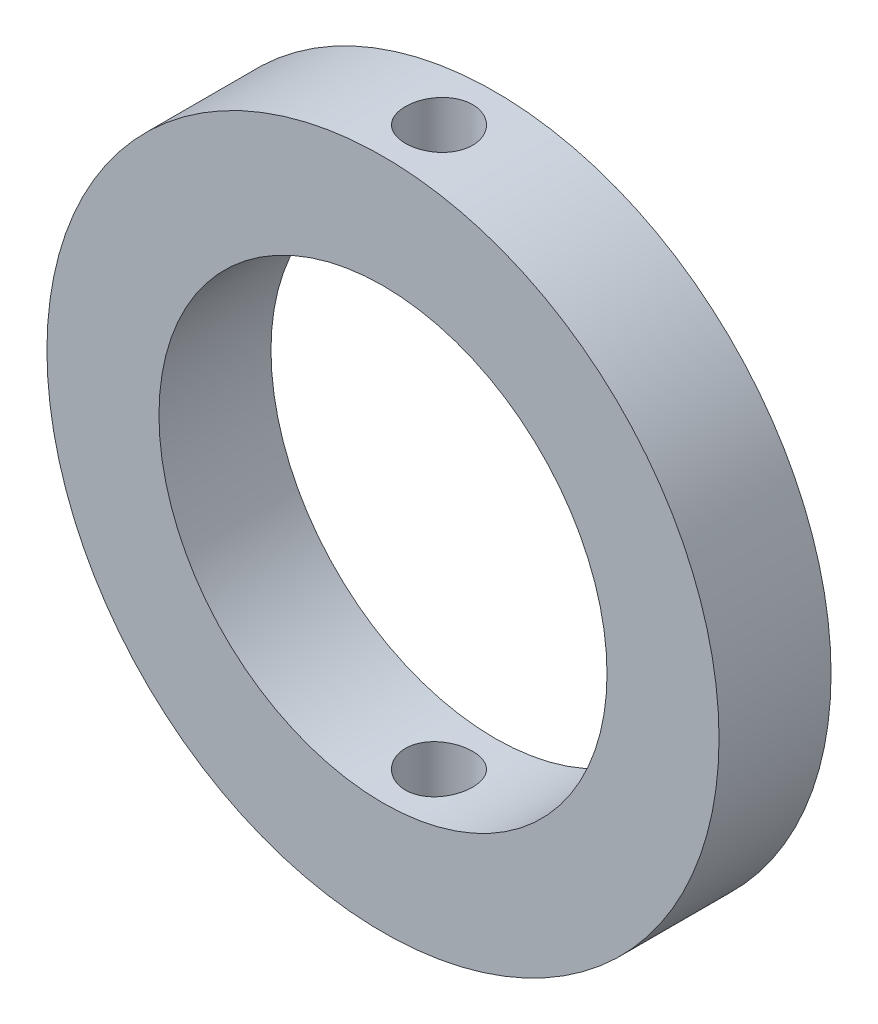
from build123d import *

# Parameters (mm, degrees)
SKETCH1_R               = 30
SKETCH1_R_2             = 20
BOSS_EXTRUDE1_DEPTH     = 10
CUT_EXTRUDE1_DEPTH      = 44.588989435
CUT_EXTRUDE1_DEPTH_BACK = 44.588989435
SKETCH2_R               = 3


with BuildPart() as part:
    # Sketch1 → Boss-Extrude1 (new body)
    with BuildSketch(Plane.XY):
        Circle(SKETCH1_R)
        Circle(SKETCH1_R_2, mode=Mode.SUBTRACT)
    extrude(amount=BOSS_EXTRUDE1_DEPTH)

    # Sketch2 → Cut-Extrude1 (cut, two sides: drawn at the far end of the back side and taken through both)
    with BuildSketch(Plane(origin=(0, 0, 0), x_dir=(1, 0, 0), z_dir=(0, 1, 0)).offset(-CUT_EXTRUDE1_DEPTH_BACK)):
        with Locations(Location((0, -5, 0), (0, 0, 270))):
            Circle(SKETCH2_R)
    extrude(amount=CUT_EXTRUDE1_DEPTH + CUT_EXTRUDE1_DEPTH_BACK, mode=Mode.SUBTRACT)


solid = part.part
